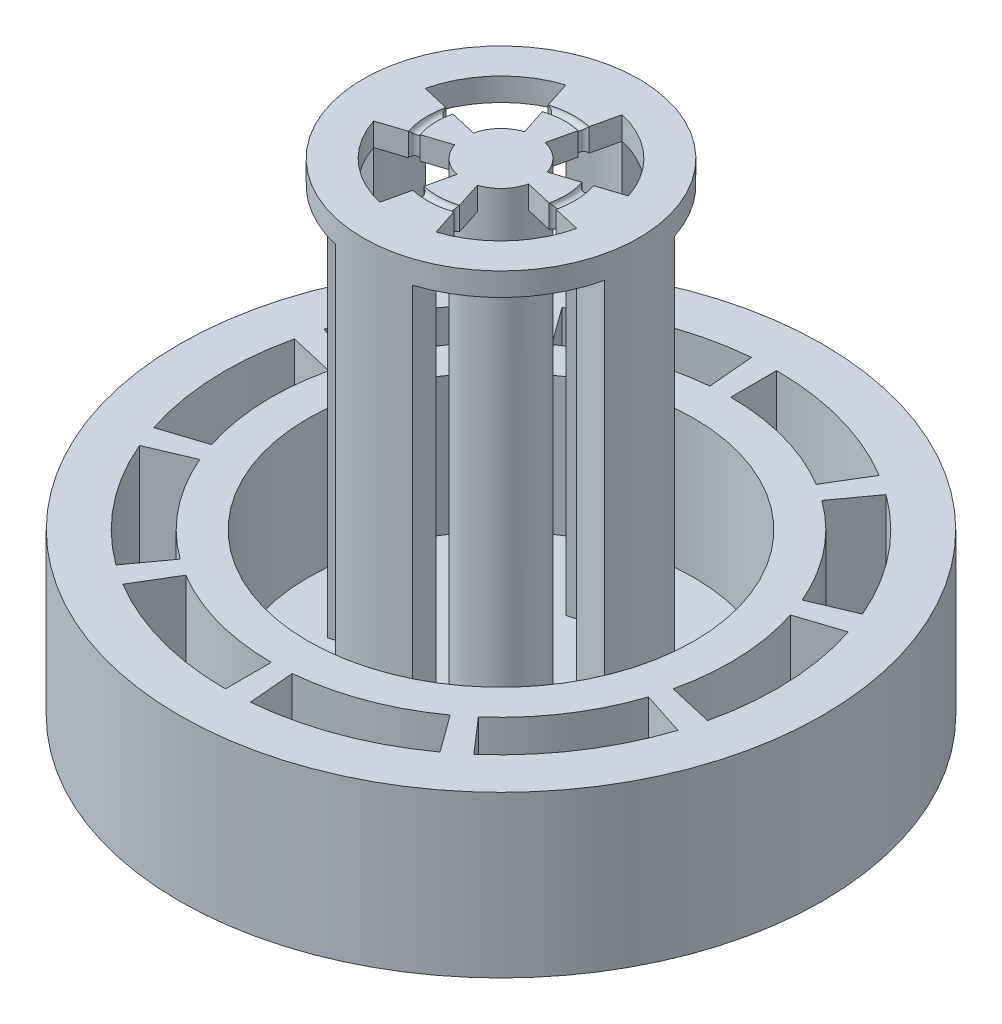
from build123d import *

# Parameters (mm, degrees)
SKETCH1_R           = 70
BOSS_EXTRUDE1_DEPTH = 5
SKETCH2_R           = 70
SKETCH2_R_2         = 42
BOSS_EXTRUDE2_DEPTH = 35
SKETCH2_10_R        = 8
BOSS_EXTRUDE3_DEPTH = 100
SKETCH4_R           = 30
BOSS_EXTRUDE4_DEPTH = 5
CUT_EXTRUDE2_REACH  = 146.309


with BuildPart() as part:
    # Sketch1 → Boss-Extrude1 (new body)
    with BuildSketch(Plane(origin=(0, 0, 0), x_dir=(1, 0, 0), z_dir=(0, 1, 0))):
        Circle(SKETCH1_R)
    extrude(amount=BOSS_EXTRUDE1_DEPTH)

    # Sketch2 → Boss-Extrude2 (add)
    with BuildSketch(Plane(origin=(0, 0, 0), x_dir=(1, 0, 0), z_dir=(0, 1, 0))):
        Circle(SKETCH2_R)
        Circle(SKETCH2_R_2, mode=Mode.SUBTRACT)
        with BuildLine():
            ThreePointArc((-25.751903746, -42.858365035), (-13.361918804, -48.18152266), (0, -50))
            Line((0, -50), (0, -60))
            ThreePointArc((0, -60), (-16.034302565, -57.817827193), (-30.902284495, -51.430038042))
            Line((-30.902284495, -51.430038042), (-25.751903746, -42.858365035))
        make_face(mode=Mode.SUBTRACT)
        with BuildLine():
            Line((-29.389262615, -40.450849719), (-35.267115138, -48.541019662))
            ThreePointArc((-35.267115138, -48.541019662), (-46.956489411, -37.350878198), (-55.230291207, -23.443867709))
            Line((-55.230291207, -23.443867709), (-46.025242673, -19.536556424))
            ThreePointArc((-46.025242673, -19.536556424), (-39.130407843, -31.125731832), (-29.389262615, -40.450849719))
        make_face(mode=Mode.SUBTRACT)
        with BuildLine():
            ThreePointArc((35.267115138, -48.541019662), (21.012442876, -56.200331355), (5.229344565, -59.771681886))
            Line((5.229344565, -59.771681886), (4.357787137, -49.809734905))
            ThreePointArc((4.357787137, -49.809734905), (17.510369063, -46.833609462), (29.389262615, -40.450849719))
            Line((29.389262615, -40.450849719), (35.267115138, -48.541019662))
        make_face(mode=Mode.SUBTRACT)
        with BuildLine():
            ThreePointArc((57.063390978, -18.541019662), (50.033149324, -33.116219119), (39.363541739, -45.282574813))
            Line((39.363541739, -45.282574813), (32.80295145, -37.735479011))
            ThreePointArc((32.80295145, -37.735479011), (41.694291103, -27.596849266), (47.552825815, -15.450849719))
            Line((47.552825815, -15.450849719), (57.063390978, -18.541019662))
        make_face(mode=Mode.SUBTRACT)
        with BuildLine():
            Line((58.462203887, -13.497063261), (48.718503239, -11.247552717))
            ThreePointArc((48.718503239, -11.247552717), (49.952411079, 2.180969368), (47.552825815, 15.450849719))
            Line((47.552825815, 15.450849719), (57.063390978, 18.541019662))
            ThreePointArc((57.063390978, 18.541019662), (59.942893295, 2.617163242), (58.462203887, -13.497063261))
        make_face(mode=Mode.SUBTRACT)
        with BuildLine():
            ThreePointArc((35.267115138, 48.541019662), (46.956489411, 37.350878198), (55.230291207, 23.443867709))
            Line((55.230291207, 23.443867709), (46.025242673, 19.536556424))
            ThreePointArc((46.025242673, 19.536556424), (39.130407843, 31.125731832), (29.389262615, 40.450849719))
            Line((29.389262615, 40.450849719), (35.267115138, 48.541019662))
        make_face(mode=Mode.SUBTRACT)
        with BuildLine():
            ThreePointArc((0, 60), (16.034302565, 57.817827193), (30.902284495, 51.430038042))
            Line((30.902284495, 51.430038042), (25.751903746, 42.858365035))
            ThreePointArc((25.751903746, 42.858365035), (13.361918804, 48.18152266), (0, 50))
            Line((0, 50), (0, 60))
        make_face(mode=Mode.SUBTRACT)
        with BuildLine():
            ThreePointArc((-35.267115138, 48.541019662), (-21.012442876, 56.200331355), (-5.229344565, 59.771681886))
            Line((-5.229344565, 59.771681886), (-4.357787137, 49.809734905))
            ThreePointArc((-4.357787137, 49.809734905), (-17.510369063, 46.833609462), (-29.389262615, 40.450849719))
            Line((-29.389262615, 40.450849719), (-35.267115138, 48.541019662))
        make_face(mode=Mode.SUBTRACT)
        with BuildLine():
            ThreePointArc((-57.063390978, 18.541019662), (-50.033149324, 33.116219119), (-39.363541739, 45.282574813))
            Line((-39.363541739, 45.282574813), (-32.80295145, 37.735479011))
            ThreePointArc((-32.80295145, 37.735479011), (-41.694291103, 27.596849266), (-47.552825815, 15.450849719))
            Line((-47.552825815, 15.450849719), (-57.063390978, 18.541019662))
        make_face(mode=Mode.SUBTRACT)
        with BuildLine():
            ThreePointArc((-57.063390978, -18.541019662), (-59.942893295, -2.617163242), (-58.462203887, 13.497063261))
            Line((-58.462203887, 13.497063261), (-48.718503239, 11.247552717))
            ThreePointArc((-48.718503239, 11.247552717), (-49.952411079, -2.180969368), (-47.552825815, -15.450849719))
            Line((-47.552825815, -15.450849719), (-57.063390978, -18.541019662))
        make_face(mode=Mode.SUBTRACT)
    extrude(amount=BOSS_EXTRUDE2_DEPTH)

    # Sketch2<10> → Boss-Extrude3 (add)
    with BuildSketch(Plane(origin=(0, 0, 0), x_dir=(1, 0, 0), z_dir=(0, 1, 0))):
        with BuildLine():
            ThreePointArc((-29.231101944, 6.74853163), (-29.971446647, -1.308581621), (-28.531695489, -9.270509831))
            Line((-28.531695489, -9.270509831), (-20.923243358, -6.798373876))
            ThreePointArc((-20.923243358, -6.798373876), (-21.979060875, -0.959626522), (-21.436141425, 4.948923196))
            Line((-21.436141425, 4.948923196), (-29.231101944, 6.74853163))
        make_face()
        with BuildLine():
            Line((-4.948923196, -21.436141425), (-6.74853163, -29.231101944))
            ThreePointArc((-6.74853163, -29.231101944), (1.308581621, -29.971446647), (9.270509831, -28.531695489))
            Line((9.270509831, -28.531695489), (6.798373876, -20.923243358))
            ThreePointArc((6.798373876, -20.923243358), (0.959626522, -21.979060875), (-4.948923196, -21.436141425))
        make_face()
        Circle(SKETCH2_10_R)
        with BuildLine():
            Line((-9.270509831, 28.531695489), (-6.798373876, 20.923243358))
            ThreePointArc((-6.798373876, 20.923243358), (-0.959626522, 21.979060875), (4.948923196, 21.436141425))
            Line((4.948923196, 21.436141425), (6.74853163, 29.231101944))
            ThreePointArc((6.74853163, 29.231101944), (-1.308581621, 29.971446647), (-9.270509831, 28.531695489))
        make_face()
        with BuildLine():
            ThreePointArc((20.923243358, 6.798373876), (21.979060875, 0.959626522), (21.436141425, -4.948923196))
            Line((21.436141425, -4.948923196), (29.231101944, -6.74853163))
            ThreePointArc((29.231101944, -6.74853163), (29.971446647, 1.308581621), (28.531695489, 9.270509831))
            Line((28.531695489, 9.270509831), (20.923243358, 6.798373876))
        make_face()
    extrude(amount=BOSS_EXTRUDE3_DEPTH)

    # Sketch4 → Boss-Extrude4 (add)
    with BuildSketch(Plane(origin=(0, 100, 0), x_dir=(1, 0, 0), z_dir=(0, 1, 0))):
        Circle(SKETCH4_R)
        with BuildLine():
            Line((21.436141425, -4.948923196), (7.794960518, -1.799608435))
            ThreePointArc((7.794960518, -1.799608435), (5.898218694, -5.404721661), (2.472135955, -7.60845213))
            Line((2.472135955, -7.60845213), (6.798373876, -20.923243358))
            ThreePointArc((6.798373876, -20.923243358), (16.22010141, -14.862984568), (21.436141425, -4.948923196))
        make_face(mode=Mode.SUBTRACT)
        with BuildLine():
            Line((20.923243358, 6.798373876), (7.60845213, 2.472135955))
            ThreePointArc((7.60845213, 2.472135955), (5.404721661, 5.898218694), (1.799608435, 7.794960518))
            Line((1.799608435, 7.794960518), (4.948923196, 21.436141425))
            ThreePointArc((4.948923196, 21.436141425), (14.862984568, 16.22010141), (20.923243358, 6.798373876))
        make_face(mode=Mode.SUBTRACT)
        with BuildLine():
            Line((-6.798373876, 20.923243358), (-2.472135955, 7.60845213))
            ThreePointArc((-2.472135955, 7.60845213), (-5.898218694, 5.404721661), (-7.794960518, 1.799608435))
            Line((-7.794960518, 1.799608435), (-21.436141425, 4.948923196))
            ThreePointArc((-21.436141425, 4.948923196), (-16.22010141, 14.862984568), (-6.798373876, 20.923243358))
        make_face(mode=Mode.SUBTRACT)
        with BuildLine():
            Line((-1.799608435, -7.794960518), (-4.948923196, -21.436141425))
            ThreePointArc((-4.948923196, -21.436141425), (-14.862984568, -16.22010141), (-20.923243358, -6.798373876))
            Line((-20.923243358, -6.798373876), (-7.60845213, -2.472135955))
            ThreePointArc((-7.60845213, -2.472135955), (-5.404721661, -5.898218694), (-1.799608435, -7.794960518))
        make_face(mode=Mode.SUBTRACT)
    extrude(amount=BOSS_EXTRUDE4_DEPTH)

    # Sketch5 → Cut-Extrude2 (cut, up to next)
    with BuildSketch(Plane(origin=(0, 105, 0), x_dir=(1, 0, 0), z_dir=(0, 1, 0)), mode=Mode.PRIVATE) as cut_extrude2_sk1:
        with BuildLine():
            Line((-15.589921037, 3.59921687), (-13.641180907, 3.149314761))
            ThreePointArc((-13.641180907, 3.149314761), (-14.840502026, 2.39989575), (-15.589921037, 3.59921687))
        make_face()
    cut_extrude2_tool1 = extrude(cut_extrude2_sk1.sketch, amount=-CUT_EXTRUDE2_REACH, mode=Mode.PRIVATE) & part.part
    # Sketch5 → Cut-Extrude2 (cut, up to next)
    with BuildSketch(Plane(origin=(0, 105, 0), x_dir=(1, 0, 0), z_dir=(0, 1, 0)), mode=Mode.PRIVATE) as cut_extrude2_sk2:
        with BuildLine():
            Line((-15.216904261, -4.94427191), (-13.314791228, -4.326237921))
            ThreePointArc((-13.314791228, -4.326237921), (-14.574864739, -3.684198399), (-15.216904261, -4.94427191))
        make_face()
    cut_extrude2_tool2 = extrude(cut_extrude2_sk2.sketch, amount=-CUT_EXTRUDE2_REACH, mode=Mode.PRIVATE) & part.part
    # Sketch5 → Cut-Extrude2 (cut, up to next)
    with BuildSketch(Plane(origin=(0, 105, 0), x_dir=(1, 0, 0), z_dir=(0, 1, 0)), mode=Mode.PRIVATE) as cut_extrude2_sk3:
        with BuildLine():
            Line((3.59921687, 15.589921037), (3.149314761, 13.641180907))
            ThreePointArc((3.149314761, 13.641180907), (2.39989575, 14.840502026), (3.59921687, 15.589921037))
        make_face()
    cut_extrude2_tool3 = extrude(cut_extrude2_sk3.sketch, amount=-CUT_EXTRUDE2_REACH, mode=Mode.PRIVATE) & part.part
    # Sketch5 → Cut-Extrude2 (cut, up to next)
    with BuildSketch(Plane(origin=(0, 105, 0), x_dir=(1, 0, 0), z_dir=(0, 1, 0)), mode=Mode.PRIVATE) as cut_extrude2_sk4:
        with BuildLine():
            Line((-4.94427191, 15.216904261), (-4.326237921, 13.314791228))
            ThreePointArc((-4.326237921, 13.314791228), (-3.684198399, 14.574864739), (-4.94427191, 15.216904261))
        make_face()
    cut_extrude2_tool4 = extrude(cut_extrude2_sk4.sketch, amount=-CUT_EXTRUDE2_REACH, mode=Mode.PRIVATE) & part.part
    # Sketch5 → Cut-Extrude2 (cut, up to next)
    with BuildSketch(Plane(origin=(0, 105, 0), x_dir=(1, 0, 0), z_dir=(0, 1, 0)), mode=Mode.PRIVATE) as cut_extrude2_sk5:
        with BuildLine():
            Line((15.589921037, -3.59921687), (13.641180907, -3.149314761))
            ThreePointArc((13.641180907, -3.149314761), (14.840502026, -2.39989575), (15.589921037, -3.59921687))
        make_face()
    cut_extrude2_tool5 = extrude(cut_extrude2_sk5.sketch, amount=-CUT_EXTRUDE2_REACH, mode=Mode.PRIVATE) & part.part
    # Sketch5 → Cut-Extrude2 (cut, up to next)
    with BuildSketch(Plane(origin=(0, 105, 0), x_dir=(1, 0, 0), z_dir=(0, 1, 0)), mode=Mode.PRIVATE) as cut_extrude2_sk6:
        with BuildLine():
            Line((15.216904261, 4.94427191), (13.314791228, 4.326237921))
            ThreePointArc((13.314791228, 4.326237921), (14.574864739, 3.684198399), (15.216904261, 4.94427191))
        make_face()
    cut_extrude2_tool6 = extrude(cut_extrude2_sk6.sketch, amount=-CUT_EXTRUDE2_REACH, mode=Mode.PRIVATE) & part.part
    # Sketch5 → Cut-Extrude2 (cut, up to next)
    with BuildSketch(Plane(origin=(0, 105, 0), x_dir=(1, 0, 0), z_dir=(0, 1, 0)), mode=Mode.PRIVATE) as cut_extrude2_sk7:
        with BuildLine():
            Line((-3.59921687, -15.589921037), (-3.149314761, -13.641180907))
            ThreePointArc((-3.149314761, -13.641180907), (-2.39989575, -14.840502026), (-3.59921687, -15.589921037))
        make_face()
    cut_extrude2_tool7 = extrude(cut_extrude2_sk7.sketch, amount=-CUT_EXTRUDE2_REACH, mode=Mode.PRIVATE) & part.part
    # Sketch5 → Cut-Extrude2 (cut, up to next)
    with BuildSketch(Plane(origin=(0, 105, 0), x_dir=(1, 0, 0), z_dir=(0, 1, 0)), mode=Mode.PRIVATE) as cut_extrude2_sk8:
        with BuildLine():
            Line((4.94427191, -15.216904261), (4.326237921, -13.314791228))
            ThreePointArc((4.326237921, -13.314791228), (3.684198399, -14.574864739), (4.94427191, -15.216904261))
        make_face()
    cut_extrude2_tool8 = extrude(cut_extrude2_sk8.sketch, amount=-CUT_EXTRUDE2_REACH, mode=Mode.PRIVATE) & part.part
    add(cut_extrude2_tool1.solids().sort_by_distance((-14.711023, 105, -2.96073))[0], mode=Mode.SUBTRACT)
    add(cut_extrude2_tool2.solids().sort_by_distance((-14.396999, 105, 4.231614))[0], mode=Mode.SUBTRACT)
    add(cut_extrude2_tool3.solids().sort_by_distance((2.96073, 105, -14.711023))[0], mode=Mode.SUBTRACT)
    add(cut_extrude2_tool4.solids().sort_by_distance((-4.231614, 105, -14.396999))[0], mode=Mode.SUBTRACT)
    add(cut_extrude2_tool5.solids().sort_by_distance((14.711023, 105, 2.96073))[0], mode=Mode.SUBTRACT)
    add(cut_extrude2_tool6.solids().sort_by_distance((14.396999, 105, -4.231614))[0], mode=Mode.SUBTRACT)
    add(cut_extrude2_tool7.solids().sort_by_distance((-2.96073, 105, 14.711023))[0], mode=Mode.SUBTRACT)
    add(cut_extrude2_tool8.solids().sort_by_distance((4.231614, 105, 14.396999))[0], mode=Mode.SUBTRACT)

    # Sketch8 → Cut-Revolve1 (revolve, cut)
    with BuildSketch(Plane(origin=(0, 0, 0), x_dir=(0.22495105434385781, 0, -0.9743700647852369), z_dir=(0.9743700647852369, 0, 0.22495105434385781))):
        with BuildLine():
            Line((16, 105), (14, 105))
            ThreePointArc((14, 105), (15, 104), (16, 105))
        make_face()
    revolve(axis=Axis((0, 65, 0), (0, -1, 0)), mode=Mode.SUBTRACT)


solid = part.part
